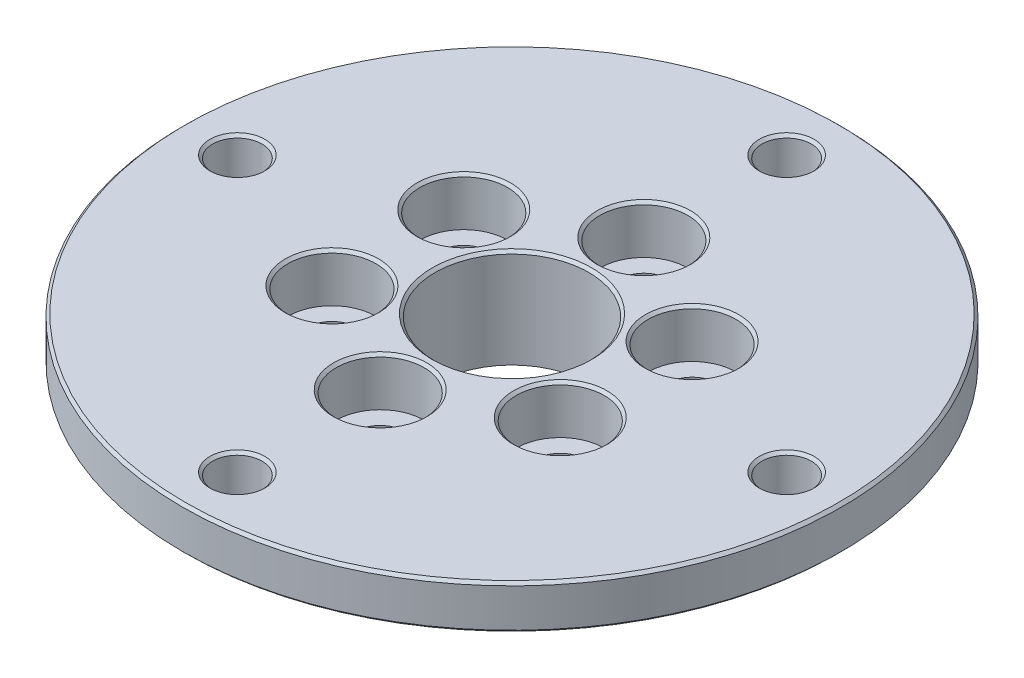
from build123d import *

# Parameters (mm, degrees)
SKIZZE1_R                                            = 20.5
SKIZZE1_R_2                                          = 7
AUFSATZ_LINEAR_AUSTRAGEN1_DEPTH                      = 5
SKIZZE3_R                                            = 30
SKIZZE3_R_2                                          = 7
AUFSATZ_LINEAR_AUSTRAGEN2_DEPTH                      = 4
DURCHGANGSLOCH_F_R_M41_D                             = 4.5
STIRNSENKUNG_F_R_M4_ZYLINDERSCHRAUBE_MIT_D           = 4.5
STIRNSENKUNG_F_R_M4_ZYLINDERSCHRAUBE_MIT_CBORE_D     = 8
STIRNSENKUNG_F_R_M4_ZYLINDERSCHRAUBE_MIT_CBORE_DEPTH = 4.4
FASE1_SIZE                                           = 0.25


with BuildPart() as part:
    # Skizze1 → Aufsatz-Linear austragen1 (new body)
    with BuildSketch(Plane(origin=(0, 0, 0), x_dir=(1, 0, 0), z_dir=(0, 1, 0))):
        with Locations(Location((0, 0, 0), (0, 0, 270))):
            Circle(SKIZZE1_R)
        with Locations(Location((0, 0, 0), (0, 0, 270))):
            Circle(SKIZZE1_R_2, mode=Mode.SUBTRACT)
    extrude(amount=AUFSATZ_LINEAR_AUSTRAGEN1_DEPTH)

    # Skizze3 → Aufsatz-Linear austragen2 (add)
    with BuildSketch(Plane(origin=(0, 5, 0), x_dir=(1, 0, 0), z_dir=(0, 1, 0))):
        with Locations(Location((0, 0, 0), (0, 0, 270))):
            Circle(SKIZZE3_R)
        with Locations(Location((0, 0, 0), (0, 0, 270))):
            Circle(SKIZZE3_R_2, mode=Mode.SUBTRACT)
    extrude(amount=AUFSATZ_LINEAR_AUSTRAGEN2_DEPTH)

    # Durchgangsloch für M41 (through all)
    with Locations(Plane(origin=(0, 5, 0), x_dir=(-1, 0, 0), z_dir=(0, -1, 0))):
        with Locations((0, 25), (-25, 0), (0, -25), (25, 0)):
            Hole(DURCHGANGSLOCH_F_R_M41_D / 2)

    # Stirnsenkung für M4 Zylinderschraube mit Innensechskant1 (through all)
    with Locations(Plane(origin=(0, 9, 0), x_dir=(1, 0, 0), z_dir=(0, 1, 0))):
        with Locations((-10.392304845, 6), (0, 12), (10.392304845, 6), (10.392304845, -6), (0, -12), (-10.392304845, -6)):
            CounterBoreHole(STIRNSENKUNG_F_R_M4_ZYLINDERSCHRAUBE_MIT_D / 2, STIRNSENKUNG_F_R_M4_ZYLINDERSCHRAUBE_MIT_CBORE_D / 2, STIRNSENKUNG_F_R_M4_ZYLINDERSCHRAUBE_MIT_CBORE_DEPTH)

    # Fase1
    fase1_edges = [part.edges().sort_by_distance(p)[0] for p in [
        (0, 9, -30),
        (0, 5, -30),
        (0, 9, -7),
        (-27.25, 5, 0),
        (-27.25, 9, 0),
        (-2.25, 5, 25),
        (-2.25, 9, 25),
        (22.75, 5, 0),
        (22.75, 9, 0),
        (-2.25, 5, -25),
        (-2.25, 9, -25),
        (-14.392304845, 9, -6),
        (0, 5, -20.5),
        (-14.392304845, 9, 6),
        (-4, 9, 12),
        (6.392304845, 9, 6),
        (6.392304845, 9, -6),
        (-4, 9, -12),
    ]]
    chamfer(fase1_edges, length=FASE1_SIZE)


solid = part.part
